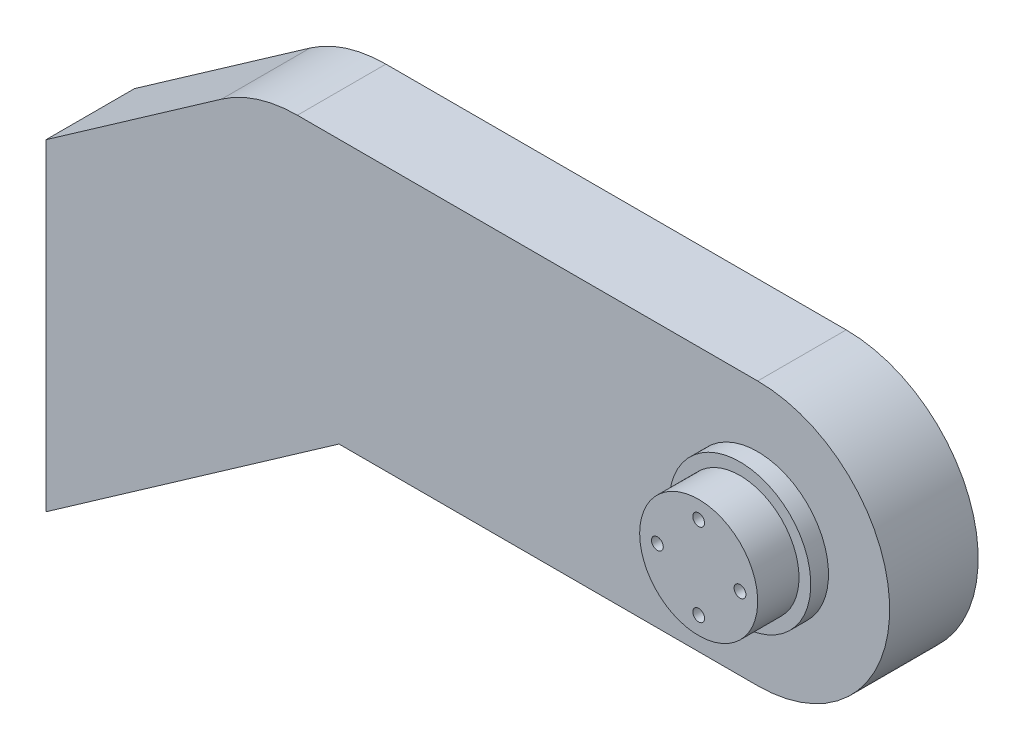
from build123d import *

# Parameters (mm, degrees)
SKETCH_1_W          = 300
SKETCH_1_H          = 44.73
EXTRUDE_1_DEPTH     = 15
CUT_EXTRUDE_4_REACH = 305.687
EXTRUDE_START       = -15
SKETCH_6_R          = 10
EXTRUDE_2_DEPTH     = 10
SKETCH_7_R          = 1
CUT_EXTRUDE_6_DEPTH = 5
EXTRUDE_5_DEPTH     = 15
CUT_EXTRUDE_7_DEPTH = 15
SKETCH_11_R         = 12
SKETCH_11_R_2       = 10
EXTRUDE_6_DEPTH     = 3


with BuildPart() as part:
    # 草图1 → 凸台-拉伸1 (new body)
    with BuildSketch(Plane.XY):
        with Locations((150, 22.365)):
            Rectangle(SKETCH_1_W, SKETCH_1_H)
    extrude(amount=EXTRUDE_1_DEPTH)

    # 草图4 → 切除-拉伸4 (cut, up to next)
    with BuildSketch(Plane.XY.offset(15), mode=Mode.PRIVATE) as cut_extrude_4_sk1:
        with BuildLine():
            Line((300, 44.73), (153.211623388, 44.73))
            ThreePointArc((153.211623388, 44.73), (175.576623388, 22.365), (153.211623388, 0))
            Line((153.211623388, 0), (300, 0))
            Line((300, 0), (300, 44.73))
        make_face()
    cut_extrude_4_tool1 = extrude(cut_extrude_4_sk1.sketch, amount=-CUT_EXTRUDE_4_REACH, mode=Mode.PRIVATE) & part.part
    add(cut_extrude_4_tool1.solids().sort_by_distance((235.292113, 22.365, 15))[0], mode=Mode.SUBTRACT)

    # 草图6 → 凸台-拉伸2 (add)
    with BuildSketch(Plane(origin=(0, 0, 0), x_dir=(-1, 0, 0), z_dir=(0, 0, -1)).offset(EXTRUDE_START)):
        with Locations((-153.211623388, 22.365)):
            Circle(SKETCH_6_R)
    extrude(amount=-EXTRUDE_2_DEPTH)

    # 草图7 → 切除-拉伸6 (cut)
    with BuildSketch(Plane.XY.offset(25)):
        with Locations((153.211623388, 29.365)):
            Circle(SKETCH_7_R)
        with Locations((160.211623388, -284.058246776)):
            Circle(SKETCH_7_R)
        with Locations((-153.211623388, -291.058246776)):
            Circle(SKETCH_7_R)
        with Locations((-160.211623388, 22.365)):
            Circle(SKETCH_7_R)
        with Locations((160.211623388, 22.365)):
            Circle(SKETCH_7_R)
        with Locations((153.211623388, 15.365)):
            Circle(SKETCH_7_R)
        with Locations((146.211623388, 22.365)):
            Circle(SKETCH_7_R)
    extrude(amount=-CUT_EXTRUDE_6_DEPTH, mode=Mode.SUBTRACT)

    # 草图9 → 凸台-拉伸5 (add)
    with BuildSketch(Plane.XY):
        Polygon((32.615717085, -34.763598368), (82.263280801, 0), (32.615717085, 0), align=None)
    extrude(amount=EXTRUDE_5_DEPTH)

    # 草图10 → 切除-拉伸7 (cut)
    with BuildSketch(Plane(origin=(0, 0, 0), x_dir=(-1, 0, 0), z_dir=(0, 0, -1))):
        with BuildLine():
            Line((-32.615717085, 19.841648987), (-32.615717085, 0))
            Line((-32.615717085, 0), (0, 0))
            Line((0, 0), (0, 44.73))
            Line((0, 44.73), (-75.211623388, 44.73))
            ThreePointArc((-75.211623388, 44.73), (-68.486338182, 43.694879603), (-62.383586389, 40.685335471))
            Line((-62.383586389, 40.685335471), (-32.615717085, 19.841648987))
        make_face()
    extrude(amount=-CUT_EXTRUDE_7_DEPTH, mode=Mode.SUBTRACT)

    # 草图11 → 凸台-拉伸6 (add)
    with BuildSketch(Plane(origin=(0, 0, 0), x_dir=(-1, 0, 0), z_dir=(0, 0, -1)).offset(EXTRUDE_START)):
        with Locations((-153.211623388, 22.365)):
            Circle(SKETCH_11_R)
        with Locations((-153.211623388, 22.365)):
            Circle(SKETCH_11_R_2, mode=Mode.SUBTRACT)
    extrude(amount=-EXTRUDE_6_DEPTH)


solid = part.part
